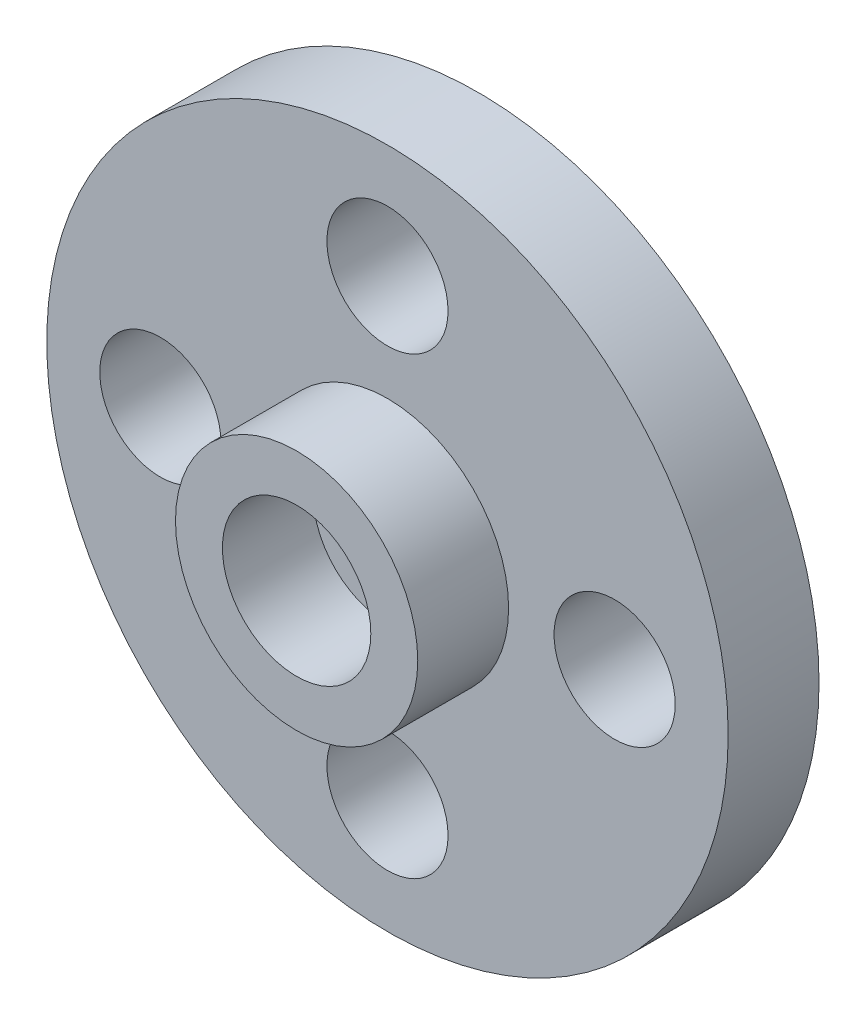
from build123d import *

# Parameters (mm, degrees)
SKIZZE1_R                       = 11.25
AUFSATZ_LINEAR_AUSTRAGEN1_DEPTH = 3
SKIZZE2_R                       = 4
SKIZZE2_R_2                     = 2.45
AUFSATZ_LINEAR_AUSTRAGEN2_DEPTH = 3
SCHNITT_LINEAR_AUSTRAGEN1_REACH = 18.19
SKIZZE3_R                       = 2


with BuildPart() as part:
    # Skizze1 → Aufsatz-Linear austragen1 (new body)
    with BuildSketch(Plane.XY):
        Circle(SKIZZE1_R)
    extrude(amount=-AUFSATZ_LINEAR_AUSTRAGEN1_DEPTH)

    # Skizze2 → Aufsatz-Linear austragen2 (add)
    with BuildSketch(Plane.XY):
        Circle(SKIZZE2_R)
        Circle(SKIZZE2_R_2, mode=Mode.SUBTRACT)
    extrude(amount=AUFSATZ_LINEAR_AUSTRAGEN2_DEPTH)

    # Skizze3 → Schnitt-Linear austragen1 (cut, up to next)
    with BuildSketch(Plane.XY, mode=Mode.PRIVATE) as schnitt_linear_austragen1_sk1:
        with Locations((0, 7.5)):
            Circle(SKIZZE3_R)
    schnitt_linear_austragen1_tool1 = extrude(schnitt_linear_austragen1_sk1.sketch, amount=-SCHNITT_LINEAR_AUSTRAGEN1_REACH, mode=Mode.PRIVATE) & part.part
    # Skizze3 → Schnitt-Linear austragen1 (cut, up to next)
    with BuildSketch(Plane.XY, mode=Mode.PRIVATE) as schnitt_linear_austragen1_sk2:
        with Locations((7.5, 0)):
            Circle(SKIZZE3_R)
    schnitt_linear_austragen1_tool2 = extrude(schnitt_linear_austragen1_sk2.sketch, amount=-SCHNITT_LINEAR_AUSTRAGEN1_REACH, mode=Mode.PRIVATE) & part.part
    # Skizze3 → Schnitt-Linear austragen1 (cut, up to next)
    with BuildSketch(Plane.XY, mode=Mode.PRIVATE) as schnitt_linear_austragen1_sk3:
        with Locations((0, -7.5)):
            Circle(SKIZZE3_R)
    schnitt_linear_austragen1_tool3 = extrude(schnitt_linear_austragen1_sk3.sketch, amount=-SCHNITT_LINEAR_AUSTRAGEN1_REACH, mode=Mode.PRIVATE) & part.part
    # Skizze3 → Schnitt-Linear austragen1 (cut, up to next)
    with BuildSketch(Plane.XY, mode=Mode.PRIVATE) as schnitt_linear_austragen1_sk4:
        with Locations((-7.5, 0)):
            Circle(SKIZZE3_R)
    schnitt_linear_austragen1_tool4 = extrude(schnitt_linear_austragen1_sk4.sketch, amount=-SCHNITT_LINEAR_AUSTRAGEN1_REACH, mode=Mode.PRIVATE) & part.part
    add(schnitt_linear_austragen1_tool1.solids().sort_by_distance((0, 7.5, 0))[0], mode=Mode.SUBTRACT)
    add(schnitt_linear_austragen1_tool2.solids().sort_by_distance((7.5, 0, 0))[0], mode=Mode.SUBTRACT)
    add(schnitt_linear_austragen1_tool3.solids().sort_by_distance((0, -7.5, 0))[0], mode=Mode.SUBTRACT)
    add(schnitt_linear_austragen1_tool4.solids().sort_by_distance((-7.5, 0, 0))[0], mode=Mode.SUBTRACT)


solid = part.part
